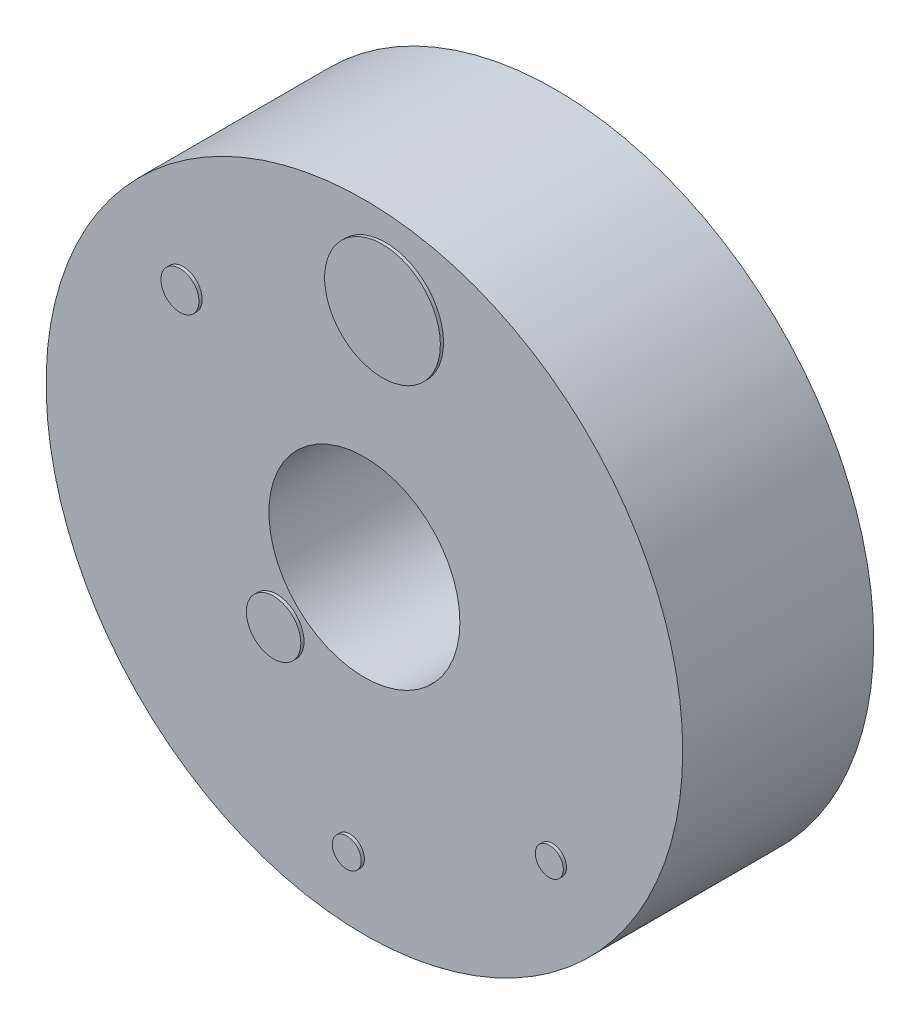
from build123d import *

# Parameters (mm, degrees)
ESBO_O1_R                = 10
ESBO_O1_R_2              = 3
RESSALTO_EXTRUS_O1_DEPTH = 6
ESBO_O2_R                = 0.597777341
ESBO_O2_R_2              = 1.817872247
ESBO_O2_R_3              = 0.440898782
ESBO_O2_R_4              = 0.855469293
ESBO_O2_R_5              = 0.454468062
RESSALTO_EXTRUS_O2_DEPTH = 0.1


with BuildPart() as part:
    # Esboço1 → Ressalto-extrusão1 (new body)
    with BuildSketch(Plane.XY):
        Circle(ESBO_O1_R)
        Circle(ESBO_O1_R_2, mode=Mode.SUBTRACT)
    extrude(amount=RESSALTO_EXTRUS_O1_DEPTH)

    # Esboço2 → Ressalto-extrusão2 (add)
    with BuildSketch(Plane.XY.offset(6)):
        with Locations((-5.694217479, 4.731814525)):
            Circle(ESBO_O2_R)
        with Locations((0.668335385, 7.351689234)):
            Circle(ESBO_O2_R_2)
        with Locations((5.908084803, -4.999148679)):
            Circle(ESBO_O2_R_3)
        with Locations((-2.753541786, -2.967409109)):
            Circle(ESBO_O2_R_4)
        with Locations((-0.454468062, -7.939824373)):
            Circle(ESBO_O2_R_5)
    extrude(amount=RESSALTO_EXTRUS_O2_DEPTH)


solid = part.part
